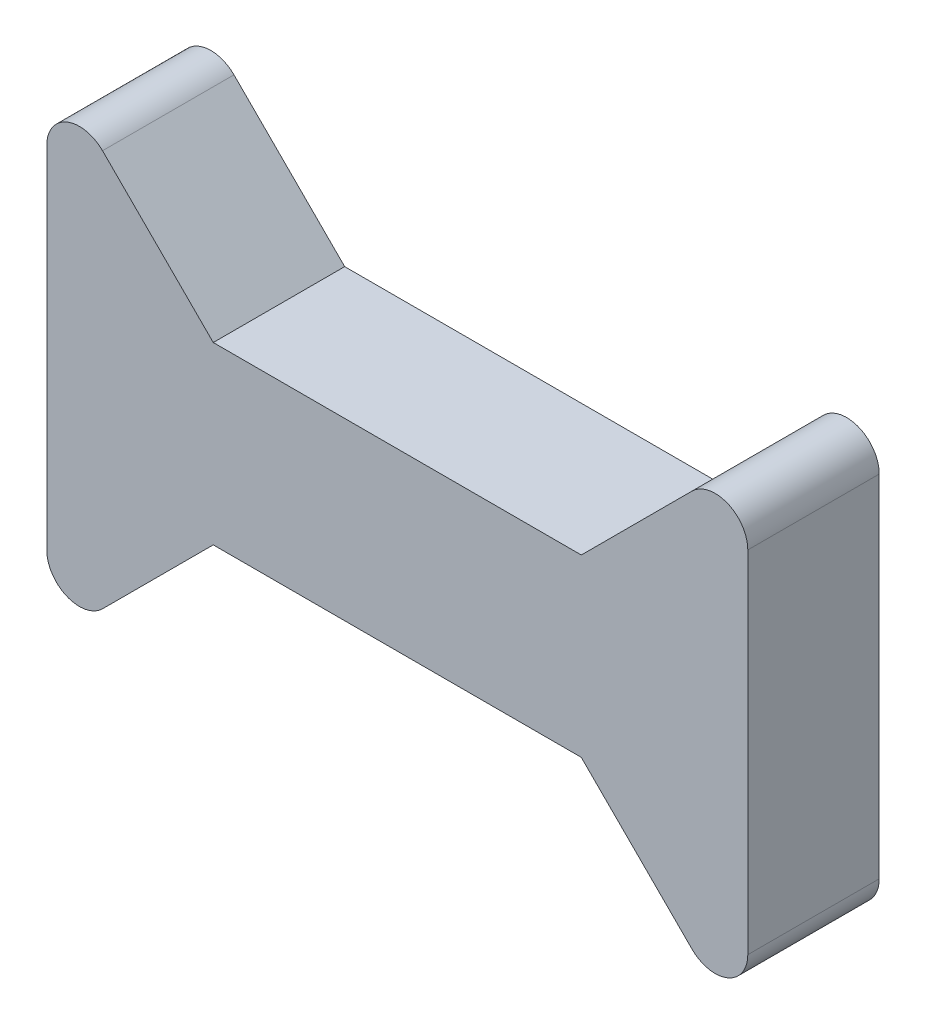
from build123d import *

# Parameters (mm, degrees)
BOSS_EXTRUDE1_DEPTH = 7.5


with BuildPart() as part:
    # Sketch1 → Boss-Extrude1 (new body)
    with BuildSketch(Plane.XY):
        with BuildLine():
            Line((-10.5, 5), (10.5, 5))
            Line((10.5, 5), (16.818019485, 11.318019485))
            ThreePointArc((16.818019485, 11.318019485), (18.849345974, 11.722075446), (20, 10))
            Line((20, 10), (20, -10))
            ThreePointArc((20, -10), (18.849345974, -11.722075446), (16.818019485, -11.318019485))
            Line((16.818019485, -11.318019485), (10.5, -5))
            Line((10.5, -5), (-10.5, -5))
            Line((-10.5, -5), (-16.818019485, -11.318019485))
            ThreePointArc((-16.818019485, -11.318019485), (-18.849345974, -11.722075446), (-20, -10))
            Line((-20, -10), (-20, 10))
            ThreePointArc((-20, 10), (-18.849345974, 11.722075446), (-16.818019485, 11.318019485))
            Line((-16.818019485, 11.318019485), (-10.5, 5))
        make_face()
    extrude(amount=BOSS_EXTRUDE1_DEPTH)


solid = part.part
